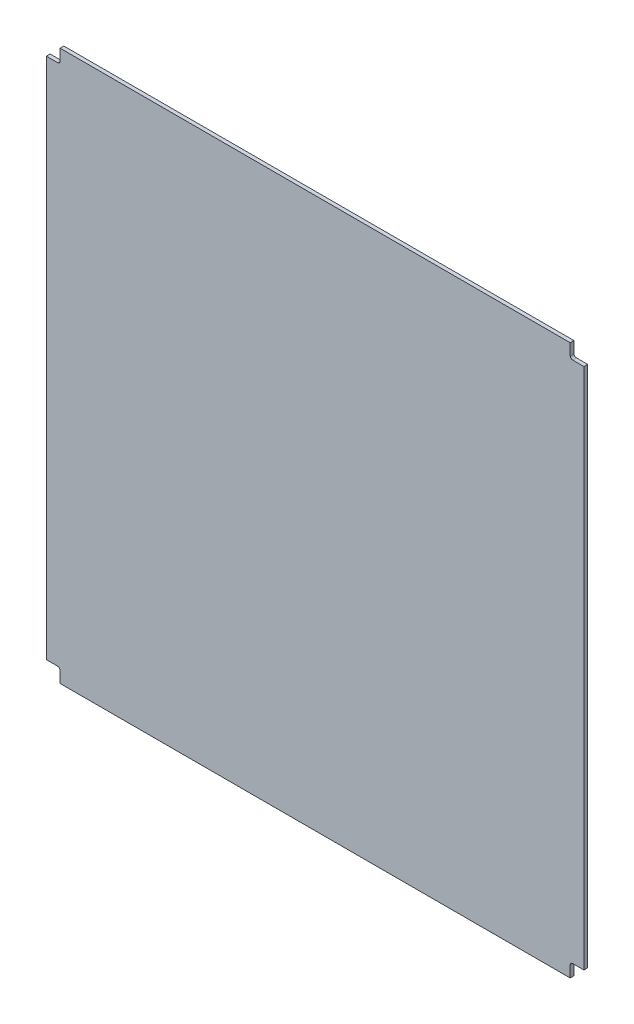
from build123d import *

# Parameters (mm, degrees)
BOSS_EXTRUDE1_DEPTH = 3


with BuildPart() as part:
    # Sketch1 → Boss-Extrude1 (new body)
    with BuildSketch(Plane.XY):
        with BuildLine():
            Line((215, -209), (215, 209))
            Line((215, 209), (206, 209))
            ThreePointArc((206, 209), (204.585786438, 209.585786438), (204, 211))
            Line((204, 211), (204, 220))
            Line((204, 220), (-204, 220))
            Line((-204, 220), (-204, 211))
            ThreePointArc((-204, 211), (-204.585786438, 209.585786438), (-206, 209))
            Line((-206, 209), (-215, 209))
            Line((-215, 209), (-215, -209))
            Line((-215, -209), (-206, -209))
            ThreePointArc((-206, -209), (-204.585786438, -209.585786438), (-204, -211))
            Line((-204, -211), (-204, -220))
            Line((-204, -220), (204, -220))
            Line((204, -220), (204, -211))
            ThreePointArc((204, -211), (204.585786438, -209.585786438), (206, -209))
            Line((206, -209), (215, -209))
        make_face()
    extrude(amount=BOSS_EXTRUDE1_DEPTH)


solid = part.part
